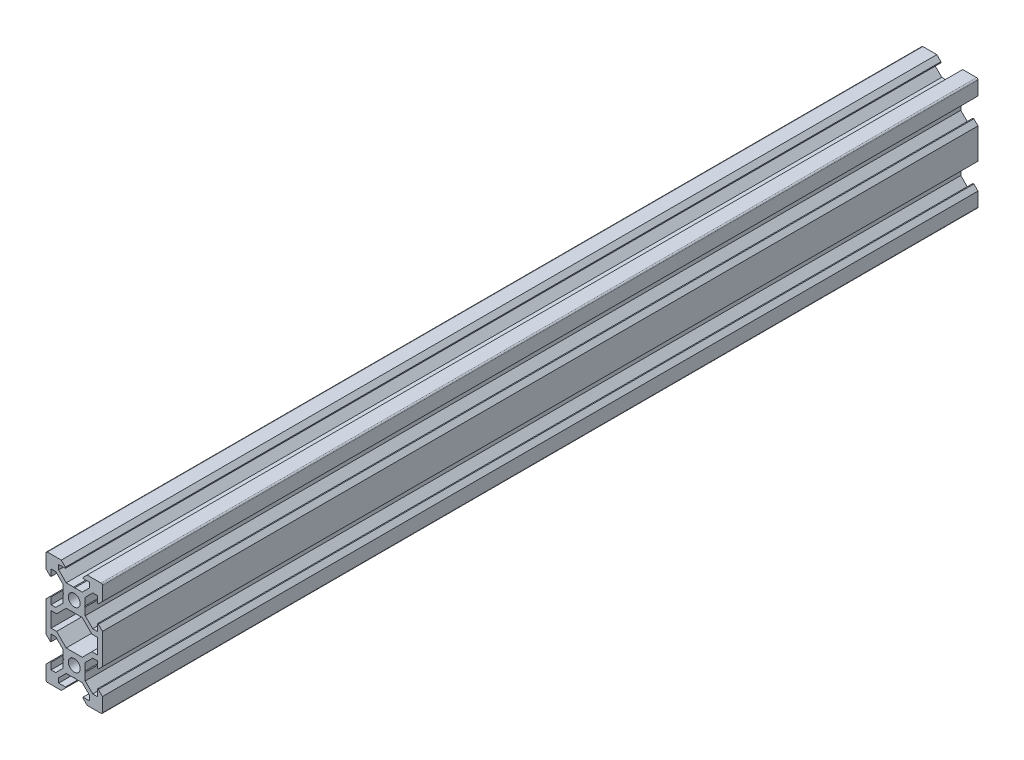
from build123d import *

# Parameters (mm, degrees)
SKETCH1_R           = 2.1
BOSS_EXTRUDE1_DEPTH = 500
SKETCH2_W           = 72.199541976
SKETCH2_H           = 58.054703084
CUT_EXTRUDE2_DEPTH  = 189.7888


with BuildPart() as part:
    # Sketch1 → Boss-Extrude1 (new body)
    with BuildSketch(Plane.XY):
        with BuildLine():
            Line((4.58, -20), (9.5, -20))
            ThreePointArc((9.5, -20), (9.853553391, -19.853553391), (10, -19.5))
            Line((10, -19.5), (10, -14.58))
            Line((10, -14.58), (8.545, -13.125))
            Line((8.545, -13.125), (8.2, -13.125))
            Line((8.2, -13.125), (8.2, -15.5))
            Line((8.2, -15.5), (6.560660172, -15.5))
            Line((6.560660172, -15.5), (3.9, -12.839339828))
            Line((3.9, -12.839339828), (3.9, -10.21))
            Line((3.9, -10.21), (3.69, -10))
            Line((3.69, -10), (3.9, -9.79))
            Line((3.9, -9.79), (3.9, -7.160660172))
            Line((3.9, -7.160660172), (6.560660172, -4.5))
            Line((6.560660172, -4.5), (8.2, -4.5))
            Line((8.2, -4.5), (8.2, -6.875))
            Line((8.2, -6.875), (8.545, -6.875))
            Line((8.545, -6.875), (10, -5.42))
            Line((10, -5.42), (10, 5.42))
            Line((10, 5.42), (8.545, 6.875))
            Line((8.545, 6.875), (8.2, 6.875))
            Line((8.2, 6.875), (8.2, 4.5))
            Line((8.2, 4.5), (6.560660172, 4.5))
            Line((6.560660172, 4.5), (3.9, 7.160660172))
            Line((3.9, 7.160660172), (3.9, 9.79))
            Line((3.9, 9.79), (3.69, 10))
            Line((3.69, 10), (3.9, 10.21))
            Line((3.9, 10.21), (3.9, 12.839339828))
            Line((3.9, 12.839339828), (6.560660172, 15.5))
            Line((6.560660172, 15.5), (8.2, 15.5))
            Line((8.2, 15.5), (8.2, 13.125))
            Line((8.2, 13.125), (8.545, 13.125))
            Line((8.545, 13.125), (10, 14.58))
            Line((10, 14.58), (10, 19.5))
            ThreePointArc((10, 19.5), (9.853553391, 19.853553391), (9.5, 20))
            Line((9.5, 20), (4.58, 20))
            Line((4.58, 20), (3.125, 18.545))
            Line((3.125, 18.545), (3.125, 18.2))
            Line((3.125, 18.2), (5.5, 18.2))
            Line((5.5, 18.2), (5.5, 16.560660172))
            Line((5.5, 16.560660172), (2.839339828, 13.9))
            Line((2.839339828, 13.9), (0.21, 13.9))
            Line((0.21, 13.9), (0, 13.69))
            Line((0, 13.69), (-0.21, 13.9))
            Line((-0.21, 13.9), (-2.839339828, 13.9))
            Line((-2.839339828, 13.9), (-5.5, 16.560660172))
            Line((-5.5, 16.560660172), (-5.5, 18.2))
            Line((-5.5, 18.2), (-3.125, 18.2))
            Line((-3.125, 18.2), (-3.125, 18.545))
            Line((-3.125, 18.545), (-4.58, 20))
            Line((-4.58, 20), (-9.5, 20))
            ThreePointArc((-9.5, 20), (-9.853553391, 19.853553391), (-10, 19.5))
            Line((-10, 19.5), (-10, 14.58))
            Line((-10, 14.58), (-8.545, 13.125))
            Line((-8.545, 13.125), (-8.2, 13.125))
            Line((-8.2, 13.125), (-8.2, 15.5))
            Line((-8.2, 15.5), (-6.560660172, 15.5))
            Line((-6.560660172, 15.5), (-3.9, 12.839339828))
            Line((-3.9, 12.839339828), (-3.9, 10.21))
            Line((-3.9, 10.21), (-3.69, 10))
            Line((-3.69, 10), (-3.9, 9.79))
            Line((-3.9, 9.79), (-3.9, 7.160660172))
            Line((-3.9, 7.160660172), (-6.560660172, 4.5))
            Line((-6.560660172, 4.5), (-8.2, 4.5))
            Line((-8.2, 4.5), (-8.2, 6.875))
            Line((-8.2, 6.875), (-8.545, 6.875))
            Line((-8.545, 6.875), (-10, 5.42))
            Line((-10, 5.42), (-10, -5.42))
            Line((-10, -5.42), (-8.545, -6.875))
            Line((-8.545, -6.875), (-8.2, -6.875))
            Line((-8.2, -6.875), (-8.2, -4.5))
            Line((-8.2, -4.5), (-6.560660172, -4.5))
            Line((-6.560660172, -4.5), (-3.9, -7.160660172))
            Line((-3.9, -7.160660172), (-3.9, -9.79))
            Line((-3.9, -9.79), (-3.69, -10))
            Line((-3.69, -10), (-3.9, -10.21))
            Line((-3.9, -10.21), (-3.9, -12.839339828))
            Line((-3.9, -12.839339828), (-6.560660172, -15.5))
            Line((-6.560660172, -15.5), (-8.2, -15.5))
            Line((-8.2, -15.5), (-8.2, -13.125))
            Line((-8.2, -13.125), (-8.545, -13.125))
            Line((-8.545, -13.125), (-10, -14.58))
            Line((-10, -14.58), (-10, -19.5))
            ThreePointArc((-10, -19.5), (-9.853553391, -19.853553391), (-9.5, -20))
            Line((-9.5, -20), (-4.58, -20))
            Line((-4.58, -20), (-3.125, -18.545))
            Line((-3.125, -18.545), (-3.125, -18.2))
            Line((-3.125, -18.2), (-5.5, -18.2))
            Line((-5.5, -18.2), (-5.5, -16.560660172))
            Line((-5.5, -16.560660172), (-2.839339828, -13.9))
            Line((-2.839339828, -13.9), (-0.21, -13.9))
            Line((-0.21, -13.9), (0, -13.69))
            Line((0, -13.69), (0.21, -13.9))
            Line((0.21, -13.9), (2.839339828, -13.9))
            Line((2.839339828, -13.9), (5.5, -16.560660172))
            Line((5.5, -16.560660172), (5.5, -18.2))
            Line((5.5, -18.2), (3.125, -18.2))
            Line((3.125, -18.2), (3.125, -18.545))
            Line((3.125, -18.545), (4.58, -20))
        make_face()
        with Locations((0, -10)):
            Circle(SKETCH1_R, mode=Mode.SUBTRACT)
        Polygon((-6.239339828, -2.7), (-8.2, -2.7), (-8.2, 2.7), (-6.239339828, 2.7), (-2.839339828, 6.1), (2.839339828, 6.1), (6.239339828, 2.7), (8.2, 2.7), (8.2, -2.7), (6.239339828, -2.7), (2.839339828, -6.1), (-2.839339828, -6.1), align=None, mode=Mode.SUBTRACT)
        with Locations((0, 10)):
            Circle(SKETCH1_R, mode=Mode.SUBTRACT)
    extrude(amount=BOSS_EXTRUDE1_DEPTH)

    # Sketch2 → Cut-Extrude2 (cut)
    with BuildSketch(Plane(origin=(0, 0, 0), x_dir=(-1, 0, 0), z_dir=(0, 0, -1))):
        with Locations((-4.42817029, -8.078427536)):
            Rectangle(SKETCH2_W, SKETCH2_H)
    extrude(amount=-CUT_EXTRUDE2_DEPTH, mode=Mode.SUBTRACT)


solid = part.part
